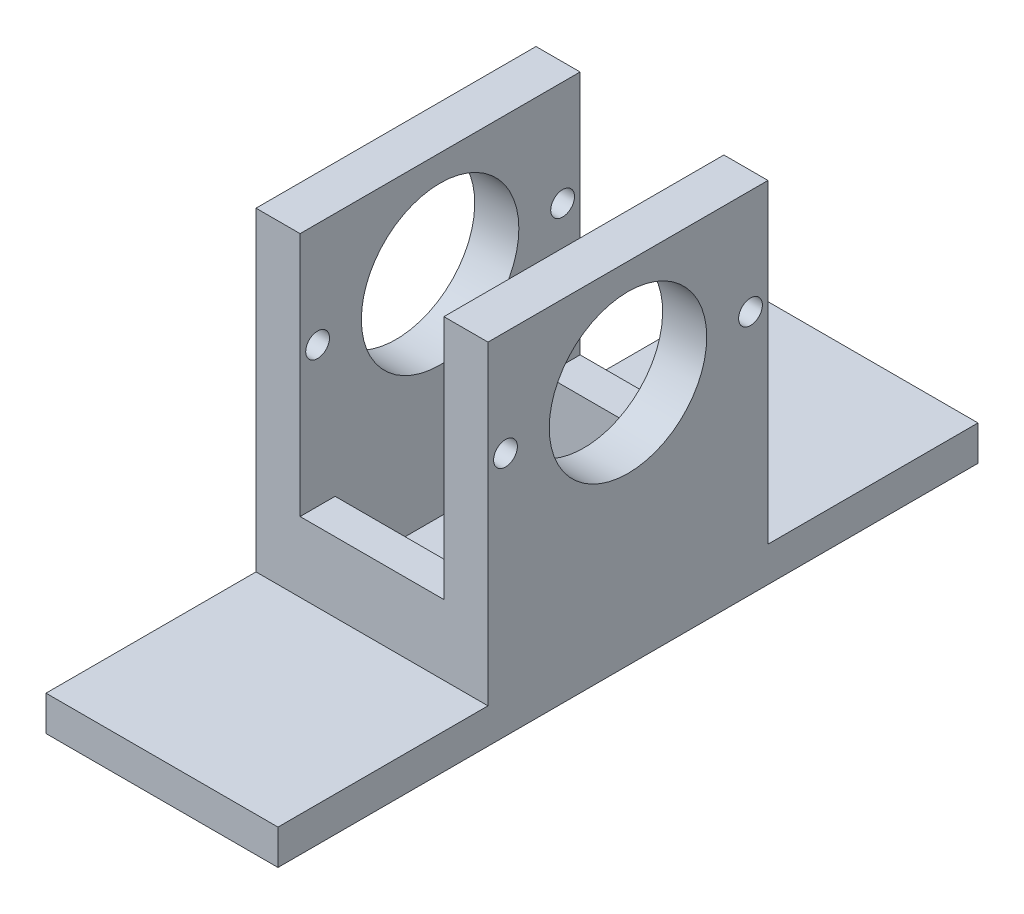
from build123d import *

# Parameters (mm, degrees)
BOSS_EXTRUDE1_DEPTH     = 25.4
CUT_EXTRUDE1_DEPTH      = 81.304376648
CUT_EXTRUDE1_DEPTH_BACK = 81.304376648
SKETCH2_R               = 14.2875
SKETCH2_R_2             = 2.159
SKETCH3_W               = 42.0878
SKETCH3_H               = 127
BOSS_EXTRUDE2_DEPTH     = 6.35
SKETCH4_W               = 26.0858
SKETCH4_H               = 12.7
BOSS_EXTRUDE3_DEPTH     = 6.35


with BuildPart() as part:
    # Sketch1 → Boss-Extrude1 (new, symmetric)
    with BuildSketch(Plane.XY):
        Polygon((-21.0439, 0), (21.0439, 0), (21.0439, 63.5), (13.0429, 63.5), (13.0429, 6.35), (-13.0429, 6.35), (-13.0429, 63.5), (-21.0439, 63.5), align=None)
    extrude(amount=BOSS_EXTRUDE1_DEPTH, both=True)

    # Sketch2 → Cut-Extrude1 (cut, two sides: drawn at the far end of the back side and taken through both)
    with BuildSketch(Plane(origin=(21.0439, 0, 0), x_dir=(0, 0, -1), z_dir=(1, 0, 0)).offset(-CUT_EXTRUDE1_DEPTH_BACK)):
        with Locations(Location((0, 44.45, 0), (0, 0, 90))):
            Circle(SKETCH2_R)
        with Locations(Location((22.225, 44.45, 0), (0, 0, 90))):
            Circle(SKETCH2_R_2)
        with Locations(Location((-22.225, 44.45, 0), (0, 0, 90))):
            Circle(SKETCH2_R_2)
    extrude(amount=CUT_EXTRUDE1_DEPTH + CUT_EXTRUDE1_DEPTH_BACK, mode=Mode.SUBTRACT)

    # Sketch3 → Boss-Extrude2 (add)
    with BuildSketch(Plane(origin=(0, 0, 0), x_dir=(-1, 0, 0), z_dir=(0, -1, 0))):
        Rectangle(SKETCH3_W, SKETCH3_H)
    extrude(amount=-BOSS_EXTRUDE2_DEPTH)

    # Sketch4 → Boss-Extrude3 (add)
    with BuildSketch(Plane(origin=(0, 0, -25.4), x_dir=(-1, 0, 0), z_dir=(0, 0, -1))):
        with Locations((0, 12.7)):
            Rectangle(SKETCH4_W, SKETCH4_H)
    boss_extrude3 = extrude(amount=-BOSS_EXTRUDE3_DEPTH)

    # Mirror1: Boss-Extrude3 across plane
    add(boss_extrude3.mirror(Plane.XY))


solid = part.part
